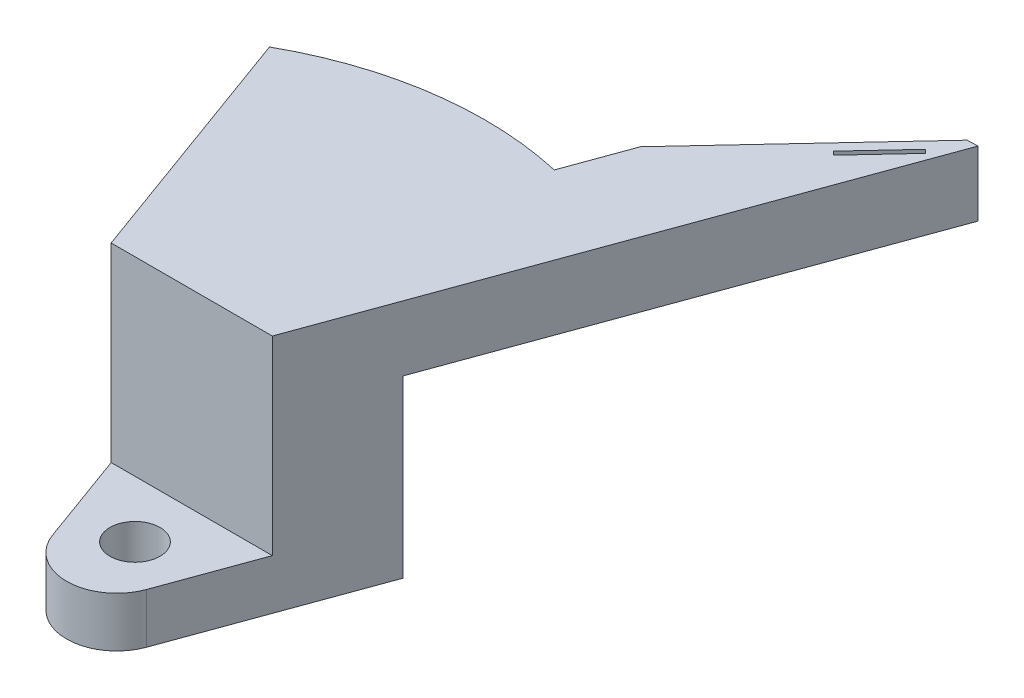
from build123d import *

# Parameters (mm, degrees)
EXTRUDE_1_DEPTH            = 48
CUT_EXTRUDE_2_REACH        = 96.508
CUT_EXTRUDE_2_START_RADIUS = 70
CUT_EXTRUDE_2_END_RADIUS   = 70
SKETCH_3_W                 = 58.404028666
SKETCH_3_H                 = 6
EXTRUDE_2_DEPTH            = 13
CUT_EXTRUDE_3_DEPTH        = 140.034418617
CUT_EXTRUDE_3_DEPTH_BACK   = 140.034418617
SKETCH_4_W                 = 25
SKETCH_4_H                 = 38
SKETCH_4_W_2               = 40
SKETCH_4_H_2               = 25
CHAMFER_1_SIZE             = 5
CHAMFER_1_SIZE2            = 3.813196151
SKETCH_6_R                 = 6.5
CUT_EXTRUDE_4_DEPTH        = 2
SKETCH_7_R                 = 1.5
CUT_EXTRUDE_5_DEPTH        = 60
SKETCH_8_W                 = 9
SKETCH_8_H                 = 9
CUT_EXTRUDE_6_DEPTH        = 11
CUT_EXTRUDE_8_REACH        = 137.533
SKETCH_10_R                = 1
CUT_EXTRUDE_9_REACH        = 105.034
CUT_EXTRUDE_9_END_RADIUS   = 70
SKETCH_11_R                = 0.75
SKETCH_12_W                = 20
SKETCH_12_H                = 3
CUT_EXTRUDE_10_DEPTH       = 11
SKETCH_13_W                = 3.868283576
SKETCH_13_H                = 1.5
CUT_EXTRUDE_11_DEPTH       = 4
CUT_EXTRUDE_12_REACH       = 137.476
SKETCH_15_W                = 94.926723873
SKETCH_15_H                = 55.523178114
CUT_EXTRUDE_13_DEPTH       = 10


with BuildPart() as part:
    # 草图1 → 凸台-拉伸1 (new body)
    with BuildSketch(Plane(origin=(0, 0, 0), x_dir=(1, 0, 0), z_dir=(0, 1, 0))):
        with BuildLine():
            ThreePointArc((-9.396926208, -7.075874358), (-5.735764364, -11.847193368), (0, -13.655672925))
            Line((0, -13.655672925), (0, -5))
            ThreePointArc((0, -5), (-5, 0), (0, 5))
            Line((0, 5), (0, 70))
            ThreePointArc((0, 70), (-17.673593853, 67.732149533), (-34.202014333, 61.075545152))
            Line((-34.202014333, 61.075545152), (-9.396926208, -7.075874358))
        make_face()
        with BuildLine():
            Line((0, -5), (0, -13.655672925))
            ThreePointArc((0, -13.655672925), (5.735764364, -11.847193368), (9.396926208, -7.075874358))
            Line((9.396926208, -7.075874358), (34.202014333, 61.075545152))
            ThreePointArc((34.202014333, 61.075545152), (17.673593853, 67.732149533), (0, 70))
            Line((0, 70), (0, 5))
            ThreePointArc((0, 5), (3.535533906, 3.535533906), (5, 0))
            ThreePointArc((5, 0), (3.535533906, -3.535533906), (0, -5))
        make_face()
    extrude(amount=EXTRUDE_1_DEPTH)

    # 切除-拉伸2: from a cylinder face, 96.508 long prism both ways, kept between that surface and its translate by the depth
    cut_extrude_2_start = Plane(origin=(0, 5, 0), z_dir=(0, -1, 0)) * Cylinder(CUT_EXTRUDE_2_START_RADIUS, 334.016, mode=Mode.PRIVATE)
    cut_extrude_2_end = Plane(origin=(0, 5, 3), z_dir=(0, -1, 0)) * Cylinder(CUT_EXTRUDE_2_END_RADIUS, 334.016, mode=Mode.PRIVATE)
    # 草图3 → 切除-拉伸2 (cut, from a surface)
    with BuildSketch(Plane.XY, mode=Mode.PRIVATE) as cut_extrude_2_sk1:
        with Locations((3, 5)):
            Rectangle(SKETCH_3_W, SKETCH_3_H)
    cut_extrude_2_tool1 = extrude(cut_extrude_2_sk1.sketch, amount=CUT_EXTRUDE_2_REACH, both=True, mode=Mode.PRIVATE)
    add(((cut_extrude_2_tool1 & cut_extrude_2_start) - cut_extrude_2_end).solids().sort_by_distance((3, 5, -62.032204))[0], mode=Mode.SUBTRACT)

    # 草图2 → 凸台-拉伸2 (add)
    with BuildSketch(Plane(origin=(0, 48, 0), x_dir=(1, 0, 0), z_dir=(0, 1, 0))):
        Polygon((24.252642572, 33.739870901), (55.034455471, 118.312206771), (20.125623779, 80.877067961), (5.458790156, 40.580273767), align=None)
    extrude(amount=-EXTRUDE_2_DEPTH)

    # 草图4 → 切除-拉伸3 (cut, two sides: drawn at the far end of the back side and taken through both)
    with BuildSketch(Plane(origin=(0, 0, 0), x_dir=(0, 0, -1), z_dir=(1, 0, 0)).offset(-CUT_EXTRUDE_3_DEPTH_BACK)):
        with Locations((-1.155672925, 29)):
            Rectangle(SKETCH_4_W, SKETCH_4_H)
        with Locations((50.466884927, 22.5)):
            Rectangle(SKETCH_4_W_2, SKETCH_4_H_2)
    extrude(amount=CUT_EXTRUDE_3_DEPTH + CUT_EXTRUDE_3_DEPTH_BACK, mode=Mode.SUBTRACT)

    # 倒角1
    chamfer_1_edges = [part.edges().sort_by_distance(p)[0] for p in [
        (55.034455471, 41.5, -118.312206771),
    ]]
    chamfer_1_side = [part.faces().sort_by_distance(p)[0] for p in [
        (37.580039625, 41.5, -99.594637366),
    ]]
    chamfer(chamfer_1_edges, length=CHAMFER_1_SIZE, length2=CHAMFER_1_SIZE2, reference=chamfer_1_side[0])

    # 草图6 → 切除-拉伸4 (cut)
    with BuildSketch(Plane.XZ):
        with Locations(Location((0, 0, 0), (0, 0, 270))):
            Circle(SKETCH_6_R)
    extrude(amount=-CUT_EXTRUDE_4_DEPTH, mode=Mode.SUBTRACT)

    # 草图7 → 切除-拉伸5 (cut)
    with BuildSketch(Plane.XY):
        with Locations((-30.202014333, 5)):
            Circle(SKETCH_7_R)
    extrude(amount=-CUT_EXTRUDE_5_DEPTH, mode=Mode.SUBTRACT)

    # 草图8 → 切除-拉伸6 (cut)
    with BuildSketch(Plane(origin=(0, 10, 0), x_dir=(1, 0, 0), z_dir=(0, 1, 0))):
        with Locations((-30.258231885, 50.240091929)):
            Rectangle(SKETCH_8_W, SKETCH_8_H)
    extrude(amount=-CUT_EXTRUDE_6_DEPTH, mode=Mode.SUBTRACT)

    # 切除-拉伸8: up to this plane
    cut_extrude_8_end = Plane(origin=(32.202014333, 48, -62.153280468), z_dir=(-1, 0, 0))
    # 草图10 → 切除-拉伸8 (cut, up to the surface)
    with BuildSketch(Plane(origin=(10.571836839, 0, 3.847833931), x_dir=(0.34202014332566283, 0, -0.9396926207859106), z_dir=(0.9396926207859106, 0, 0.34202014332566283)), mode=Mode.PRIVATE) as cut_extrude_8_sk1:
        with Locations((67.590016934, 5)):
            Circle(SKETCH_10_R)
    cut_extrude_8_tool1 = split(extrude(cut_extrude_8_sk1.sketch, amount=-CUT_EXTRUDE_8_REACH, mode=Mode.PRIVATE), bisect_by=cut_extrude_8_end, keep=Keep.BOTH, mode=Mode.PRIVATE)
    add(cut_extrude_8_tool1.solids().sort_by_distance((33.688984, 5, -59.666006))[0], mode=Mode.SUBTRACT)

    # 切除-拉伸9: up to this cylinder (the profile starts inside it)
    cut_extrude_9_end = Plane(origin=(0, 5, 0), z_dir=(0, -1, 0)) * Cylinder(CUT_EXTRUDE_9_END_RADIUS, 351.068, mode=Mode.PRIVATE)
    # 草图11 → 切除-拉伸9 (cut, up to the surface)
    with BuildSketch(Plane.XY.offset(-60), mode=Mode.PRIVATE) as cut_extrude_9_sk1:
        with Locations((-30.202014333, 5)):
            Circle(SKETCH_11_R)
    cut_extrude_9_tool1 = extrude(cut_extrude_9_sk1.sketch, amount=-CUT_EXTRUDE_9_REACH, mode=Mode.PRIVATE) & cut_extrude_9_end
    add(cut_extrude_9_tool1.solids().sort_by_distance((-30.202014, 5, -60))[0], mode=Mode.SUBTRACT)

    # 草图12 → 切除-拉伸10 (cut)
    with BuildSketch(Plane(origin=(0, 10, 0), x_dir=(1, 0, 0), z_dir=(0, 1, 0))):
        with Locations((8.346963974, 51.411545488)):
            Rectangle(SKETCH_12_W, SKETCH_12_H)
    extrude(amount=-CUT_EXTRUDE_10_DEPTH, mode=Mode.SUBTRACT)

    # 草图13 → 切除-拉伸11 (cut)
    with BuildSketch(Plane(origin=(0, 10, 0), x_dir=(1, 0, 0), z_dir=(0, 1, 0))):
        with Locations((29.542762739, 51.411545488)):
            Rectangle(SKETCH_13_W, SKETCH_13_H)
    extrude(amount=-CUT_EXTRUDE_11_DEPTH, mode=Mode.SUBTRACT)

    # 草图14 → 切除-拉伸12 (cut, up to next)
    with BuildSketch(Plane(origin=(0, 48, 0), x_dir=(1, 0, 0), z_dir=(0, 1, 0)), mode=Mode.PRIVATE) as cut_extrude_12_sk1:
        Polygon((49.766128767, 108.223290792), (49.034775066, 108.905289152), (40.168796385, 99.397691031), (40.900150086, 98.715692671), align=None)
    cut_extrude_12_tool1 = extrude(cut_extrude_12_sk1.sketch, amount=-CUT_EXTRUDE_12_REACH, mode=Mode.PRIVATE) & part.part
    add(cut_extrude_12_tool1.solids().sort_by_distance((44.967463, 48, -103.810491))[0], mode=Mode.SUBTRACT)

    # 草图15 → 切除-拉伸13 (cut)
    with BuildSketch(Plane(origin=(0, 10, 0), x_dir=(1, 0, 0), z_dir=(0, 1, 0))):
        with Locations((-0.892742436, 58.228473984)):
            Rectangle(SKETCH_15_W, SKETCH_15_H)
    extrude(amount=-CUT_EXTRUDE_13_DEPTH, mode=Mode.SUBTRACT)


solid = part.part
